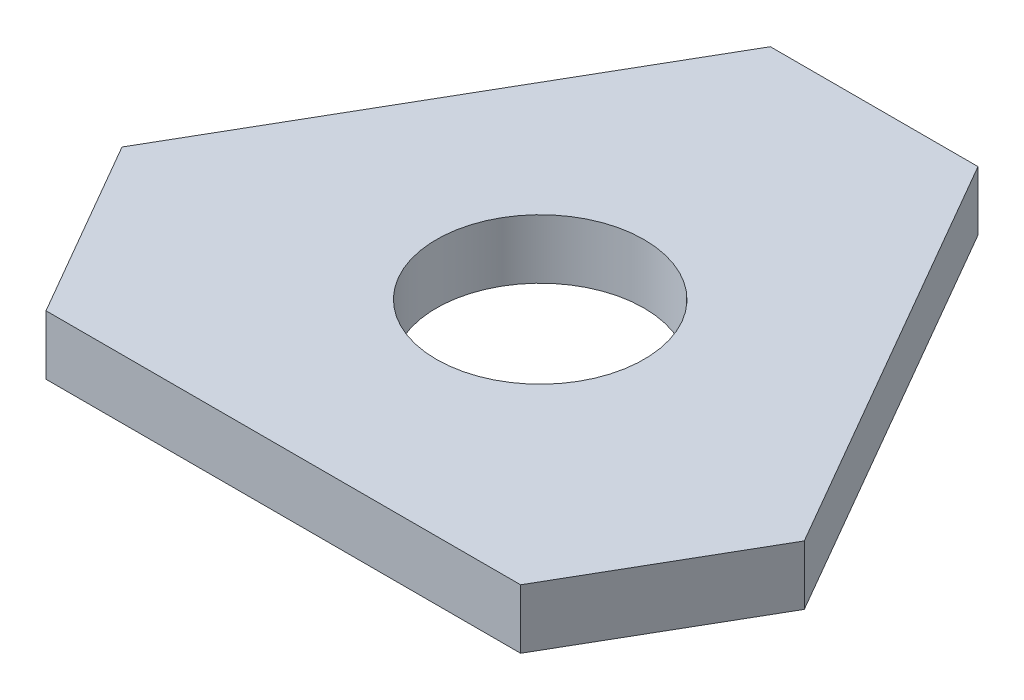
from build123d import *

# Parameters (mm, degrees)
SKETCH1_R            = 17.5
BOSS_EXTRUDE1_DEPTH  = 10
CHAMFER1_SIZE        = 35
CHAMFER1_EDGE_2_SIZE = 35
CHAMFER1_EDGE_3_SIZE = 35


with BuildPart() as part:
    # Sketch1 → Boss-Extrude1 (new body)
    with BuildSketch(Plane(origin=(0, 0, 0), x_dir=(1, 0, 0), z_dir=(0, 1, 0))):
        Polygon((-5.037101102, -3.128878012), (144.962898898, -3.128878012), (69.962898898, 126.774932556), align=None)
        with Locations(Location((69.962898898, 40.172392178, 0), (0, 0, 270))):
            Circle(SKETCH1_R, mode=Mode.SUBTRACT)
    extrude(amount=BOSS_EXTRUDE1_DEPTH)

    # Chamfer1
    chamfer1_edges = [part.edges().sort_by_distance(p)[0] for p in [
        (69.962898898, 5, -126.774932556),
    ]]
    chamfer(chamfer1_edges, length=CHAMFER1_SIZE)

    # Chamfer1 edge 2
    chamfer1_edge_2_edges = [part.edges().sort_by_distance(p)[0] for p in [
        (144.962898898, 5, 3.128878012),
    ]]
    chamfer(chamfer1_edge_2_edges, length=CHAMFER1_EDGE_2_SIZE)

    # Chamfer1 edge 3
    chamfer1_edge_3_edges = [part.edges().sort_by_distance(p)[0] for p in [
        (-5.037101102, 5, 3.128878012),
    ]]
    chamfer(chamfer1_edge_3_edges, length=CHAMFER1_EDGE_3_SIZE)


solid = part.part
